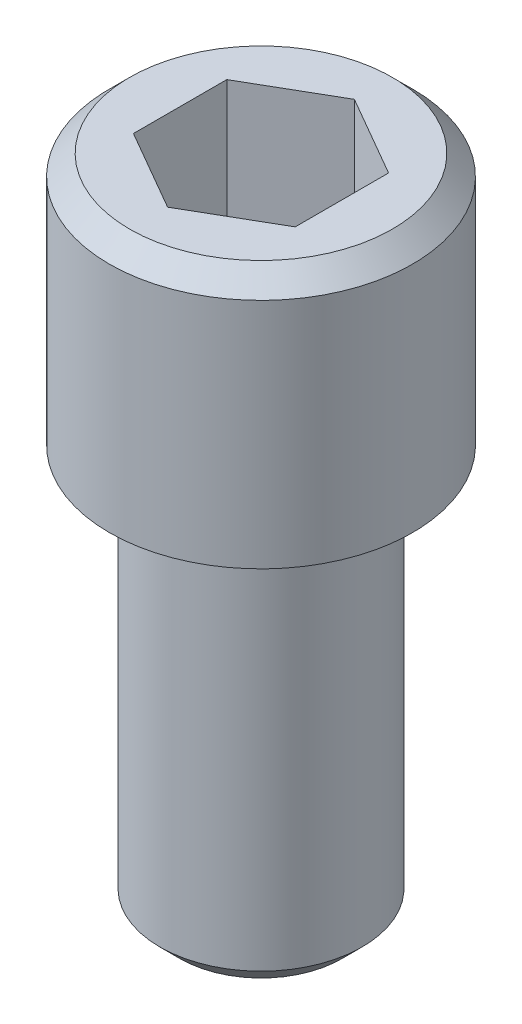
from build123d import *

# Parameters (mm, degrees)
SKICA1_R                 = 1.25
P_IDAT_VYSUNUT_M1_DEPTH  = 5
SKICA2_R                 = 1.875
P_IDAT_VYSUNUT_M2_DEPTH  = 3.125
ODEBRAT_VYSUNUT_M1_DEPTH = 1.875
ZKOSEN_1_SIZE            = 0.25


with BuildPart() as part:
    # Skica1 → Přidat vysunutím1 (new body)
    with BuildSketch(Plane(origin=(0, 0, 0), x_dir=(1, 0, 0), z_dir=(0, 1, 0))):
        with Locations(Location((0, 0, 0), (0, 0, 270))):
            Circle(SKICA1_R)
    extrude(amount=P_IDAT_VYSUNUT_M1_DEPTH)

    # Skica2 → Přidat vysunutím2 (add)
    with BuildSketch(Plane(origin=(0, 5, 0), x_dir=(1, 0, 0), z_dir=(0, 1, 0))):
        with Locations(Location((0, 0, 0), (0, 0, 270))):
            Circle(SKICA2_R)
    extrude(amount=P_IDAT_VYSUNUT_M2_DEPTH)

    # Skica3 → Odebrat vysunutím1 (cut)
    with BuildSketch(Plane(origin=(0, 8.125, 0), x_dir=(1, 0, 0), z_dir=(0, 1, 0))):
        Polygon((0, 1.154700538), (-1, 0.577350269), (-1, -0.577350269), (0, -1.154700538), (1, -0.577350269), (1, 0.577350269), align=None)
    extrude(amount=-ODEBRAT_VYSUNUT_M1_DEPTH, mode=Mode.SUBTRACT)

    # Zkosení1
    zkosen_1_edges = [part.edges().sort_by_distance(p)[0] for p in [
        (0, 0, -1.25),
        (0, 8.125, -1.875),
    ]]
    chamfer(zkosen_1_edges, length=ZKOSEN_1_SIZE)


solid = part.part
